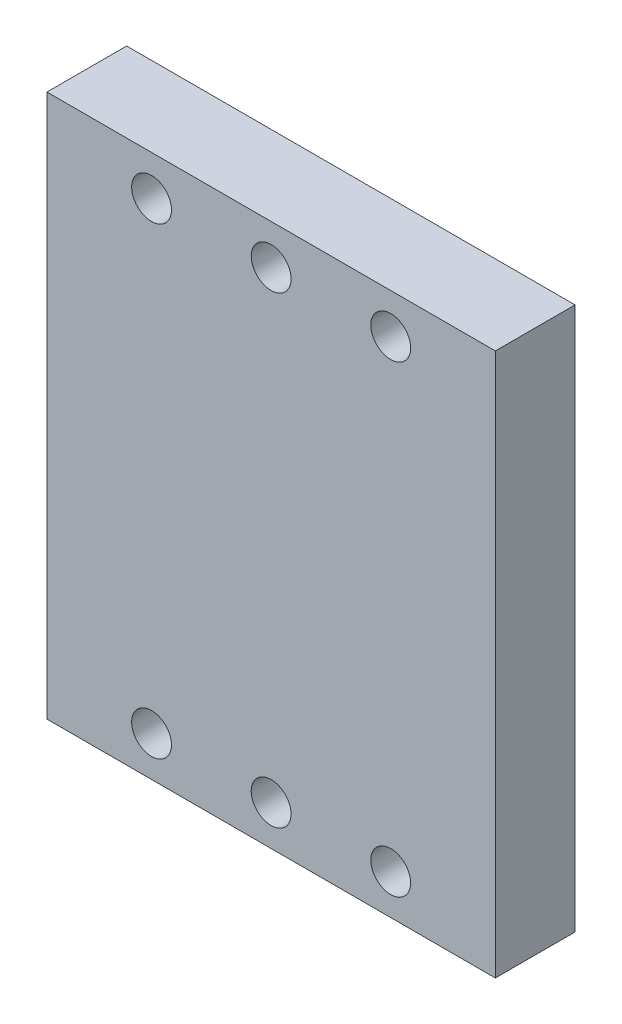
from build123d import *

# Parameters (mm, degrees)
ESQUISSE1_W             = 45
ESQUISSE1_H             = 54.5
BOSS_EXTRU_1_DEPTH      = 8
ESQUISSE2_R             = 2
ENL_V_MAT_EXTRU_1_DEPTH = 8


with BuildPart() as part:
    # Esquisse1 → Boss.-Extru.1 (new body)
    with BuildSketch(Plane.XY):
        with Locations((22.5, 27.25)):
            Rectangle(ESQUISSE1_W, ESQUISSE1_H)
    extrude(amount=BOSS_EXTRU_1_DEPTH)

    # Esquisse2 → Enlèv. mat.-Extru.1 (cut)
    with BuildSketch(Plane.XY.offset(8)):
        with Locations(Location((10.5, 4, 0), (0, 0, 180))):
            Circle(ESQUISSE2_R)
        with Locations((34.5, 4)):
            Circle(ESQUISSE2_R)
        with Locations((22.5, 4)):
            Circle(ESQUISSE2_R)
        with Locations(Location((22.5, 50.5, 0), (0, 0, 180))):
            Circle(ESQUISSE2_R)
        with Locations(Location((34.5, 50.5, 0), (0, 0, 180))):
            Circle(ESQUISSE2_R)
        with Locations((10.5, 50.5)):
            Circle(ESQUISSE2_R)
    extrude(amount=-ENL_V_MAT_EXTRU_1_DEPTH, mode=Mode.SUBTRACT)


solid = part.part
